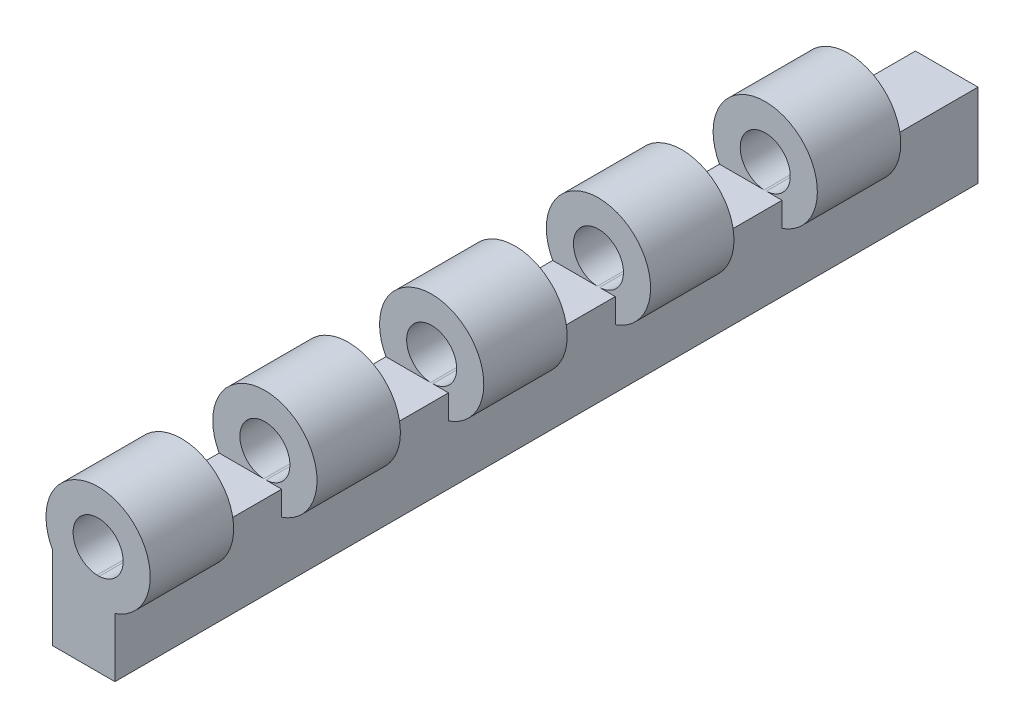
from build123d import *

# Parameters (mm, degrees)
SKETCH1_W           = 15
SKETCH1_H           = 207
BOSS_EXTRUDE1_DEPTH = 20
SKETCH2_R           = 12.5
SKETCH2_R_2         = 6
BOSS_EXTRUDE2_DEPTH = 20
LPATTERN1_COUNT     = 5
LPATTERN1_PITCH     = 40


with BuildPart() as part:
    # Sketch1 → Boss-Extrude1 (new body)
    with BuildSketch(Plane(origin=(0, 0, 0), x_dir=(1, 0, 0), z_dir=(0, 1, 0))):
        with Locations((7.5, 0)):
            Rectangle(SKETCH1_W, SKETCH1_H)
    extrude(amount=BOSS_EXTRUDE1_DEPTH)

    # Sketch2 → Boss-Extrude2 (add)
    with BuildSketch(Plane.XY.offset(103.5)):
        with Locations((10.969005493, 25.994240443)):
            Circle(SKETCH2_R)
        with Locations((10.969005493, 25.994240443)):
            Circle(SKETCH2_R_2, mode=Mode.SUBTRACT)
    boss_extrude2 = extrude(amount=-BOSS_EXTRUDE2_DEPTH)

    # LPattern1: Boss-Extrude2 ×5
    with Locations(*[(0, 0, -i * LPATTERN1_PITCH) for i in range(1, LPATTERN1_COUNT)]):
        add(boss_extrude2)


solid = part.part
